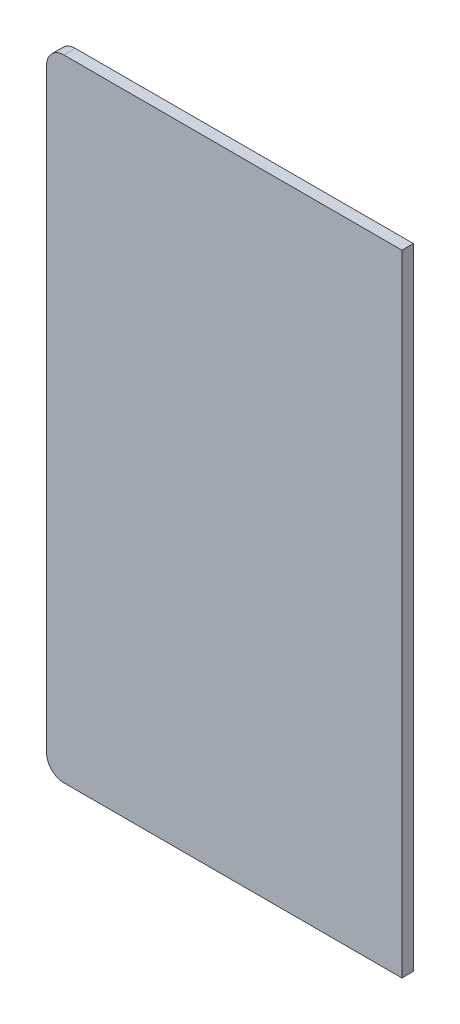
from build123d import *

# Parameters (mm, degrees)
BOSS_EXTRUDE1_DEPTH = 25.4


with BuildPart() as part:
    # Sketch1 → Boss-Extrude1 (new body)
    with BuildSketch(Plane.XY):
        with BuildLine():
            Line((63.5, 1422.4), (63.5, 101.6))
            ThreePointArc((63.5, 101.6), (74.659231637, 74.659231637), (101.6, 63.5))
            Line((101.6, 63.5), (850.9, 63.5))
            Line((850.9, 63.5), (850.9, 1460.5))
            Line((850.9, 1460.5), (101.6, 1460.5))
            ThreePointArc((101.6, 1460.5), (74.659231637, 1449.340768363), (63.5, 1422.4))
        make_face()
    extrude(amount=BOSS_EXTRUDE1_DEPTH)


solid = part.part
